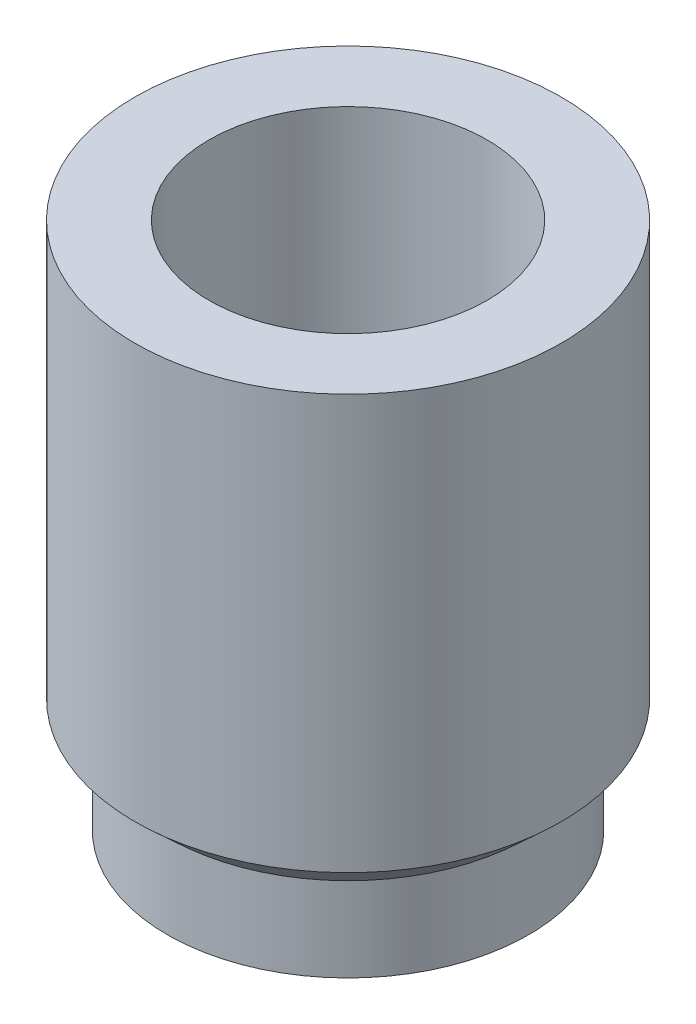
from build123d import *

# Parameters (mm, degrees)
CUT_EXTRUDE1_DEPTH      = 7.562773804
CUT_EXTRUDE1_DEPTH_BACK = 7.562773804
SKETCH2_R               = 1.5


with BuildPart() as part:
    # Sketch1 → Revolve1 (revolve)
    with BuildSketch(Plane.XY, mode=Mode.PRIVATE) as revolve1_sk:
        Polygon((0, 0), (1.95, 0), (1.95, 0.90826831), (2.3, 1.231343027), (2.3, 5.7), (0, 5.7), align=None)
    revolve(revolve1_sk.sketch.rotate(Axis((0, 5.7, 0), (0, -1, 0)), 180), axis=Axis((0, 5.7, 0), (0, -1, 0)))

    # Sketch2 → Cut-Extrude1 (cut, two sides: drawn at the far end of the back side and taken through both)
    with BuildSketch(Plane(origin=(0, 5.7, 0), x_dir=(1, 0, 0), z_dir=(0, 1, 0)).offset(-CUT_EXTRUDE1_DEPTH_BACK)):
        with Locations(Location((0, 0, 0), (0, 0, 180))):
            Circle(SKETCH2_R)
    extrude(amount=CUT_EXTRUDE1_DEPTH + CUT_EXTRUDE1_DEPTH_BACK, mode=Mode.SUBTRACT)


solid = part.part
